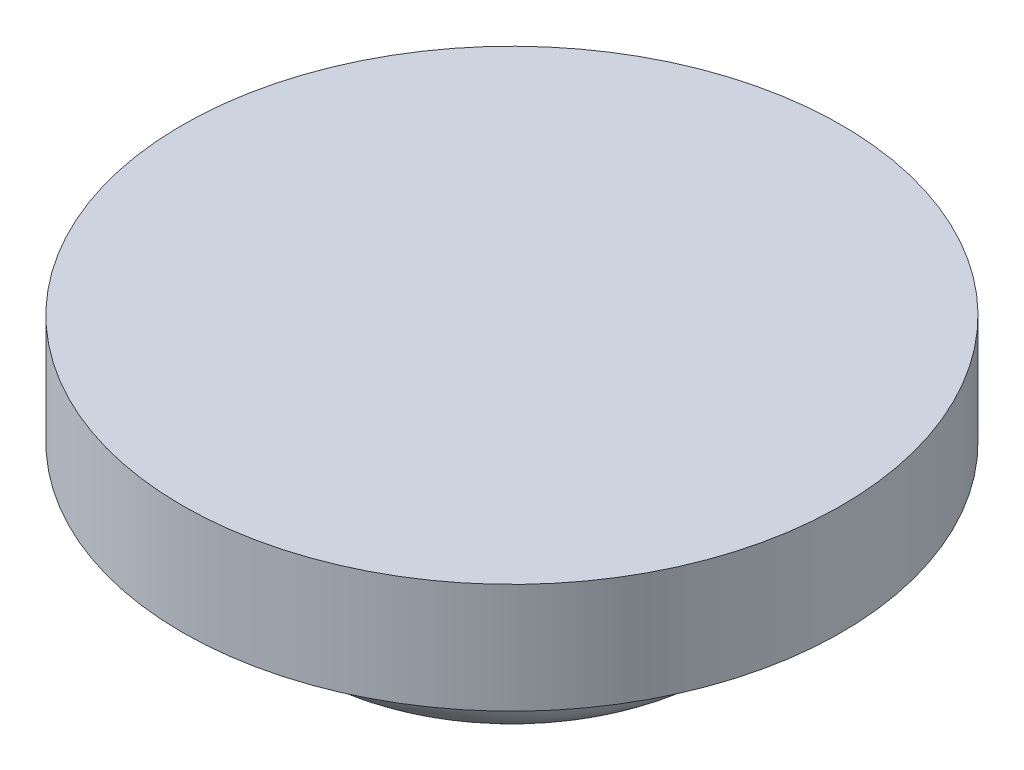
from build123d import *

# Parameters (mm, degrees)
SZKIC1_R                    = 10
DODANIE_WYCI_GNI_CIE1_DEPTH = 5
ZAOKR_GLENIE3_R             = 2
SZKIC2_R                    = 15
DODANIE_WYCI_GNI_CIE2_DEPTH = 5


with BuildPart() as part:
    # Szkic1 → Dodanie-wyciągnięcie1 (new body)
    with BuildSketch(Plane(origin=(0, 0, 0), x_dir=(1, 0, 0), z_dir=(0, 1, 0))):
        with Locations(Location((0, 0, 0), (0, 0, 270))):
            Circle(SZKIC1_R)
    extrude(amount=DODANIE_WYCI_GNI_CIE1_DEPTH)

    # Zaokrąglenie3
    zaokr_glenie3_edges = [part.edges().sort_by_distance(p)[0] for p in [
        (0, 0, -10),
    ]]
    fillet(zaokr_glenie3_edges, radius=ZAOKR_GLENIE3_R)

    # Szkic2 → Dodanie-wyciągnięcie2 (add)
    with BuildSketch(Plane(origin=(0, 5, 0), x_dir=(1, 0, 0), z_dir=(0, 1, 0))):
        with Locations(Location((0, 0, 0), (0, 0, 270))):
            Circle(SZKIC2_R)
    extrude(amount=DODANIE_WYCI_GNI_CIE2_DEPTH)


solid = part.part
